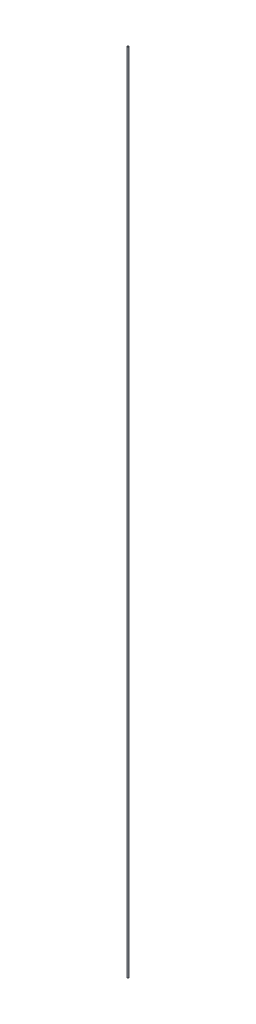
from build123d import *

# Parameters (mm, degrees)
SWEEP1_PROFILE_R = 6.35


with BuildPart() as part:
    # Sweep1: sweep along a path in Sketch1
    with BuildLine(Plane.XY) as sweep1_path:
        Line((0, 0), (0, 7872.984))
    # Sweep1 profile (on start of the path) → Sweep1 (sweep)
    with BuildSketch(Plane.ZX):
        Circle(SWEEP1_PROFILE_R)
    sweep(path=sweep1_path.line)


solid = part.part
